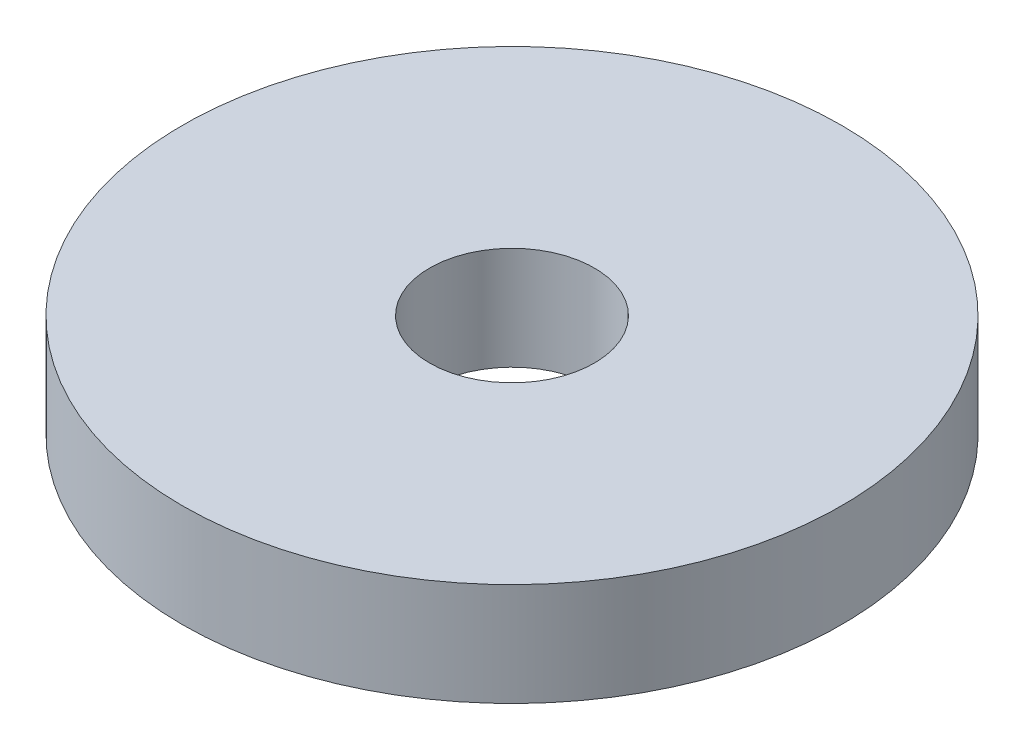
from build123d import *

# Parameters (mm, degrees)
SKETCH1_R           = 16
SKETCH1_R_2         = 4
BOSS_EXTRUDE1_DEPTH = 5


with BuildPart() as part:
    # Sketch1 → Boss-Extrude1 (new body)
    with BuildSketch(Plane(origin=(0, 0, 0), x_dir=(1, 0, 0), z_dir=(0, 1, 0))):
        with Locations(Location((0, 0, 0), (0, 0, 270))):
            Circle(SKETCH1_R)
        with Locations(Location((0, 0, 0), (0, 0, 270))):
            Circle(SKETCH1_R_2, mode=Mode.SUBTRACT)
    extrude(amount=BOSS_EXTRUDE1_DEPTH)


solid = part.part
